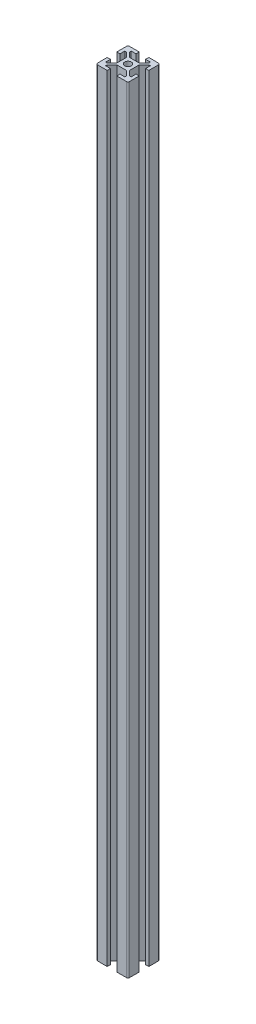
from build123d import *

# Parameters (mm, degrees)
SKETCH1_W           = 8
SKETCH1_H           = 8
SKETCH1_R           = 2.1
BOSS_EXTRUDE1_DEPTH = 485
FILLET1_R           = 1


with BuildPart() as part:
    # Sketch1 → Boss-Extrude1 (new body)
    # profile 1 of 6: a face of its own
    with BuildSketch(Plane(origin=(0, 0, 0), x_dir=(1, 0, 0), z_dir=(0, 1, 0))):
        Polygon((-4, 4), (-10, 10), (-10, 3), (-8, 3), (-8, 6), (-7, 6), (-4, 3), align=None)
    # profile 2 of 6: a face of its own
    with BuildSketch(Plane(origin=(0, 0, 0), x_dir=(1, 0, 0), z_dir=(0, 1, 0))):
        Polygon((-3, 8), (-3, 10), (-10, 10), (-4, 4), (-3, 4), (-6, 7), (-6, 8), align=None)
    # profile 3 of 6: a face of its own
    with BuildSketch(Plane(origin=(0, 0, 0), x_dir=(1, 0, 0), z_dir=(0, 1, 0))):
        Polygon((6, 7), (3, 4), (4, 4), (4, 3), (7, 6), (8, 6), (8, 3), (10, 3), (10, 10), (3, 10), (3, 8), (6, 8), align=None)
    # profile 4 of 6: a face of its own
    with BuildSketch(Plane(origin=(0, 0, 0), x_dir=(1, 0, 0), z_dir=(0, 1, 0))):
        Rectangle(SKETCH1_W, SKETCH1_H)
        with Locations(Location((0, 0, 0), (0, 0, 270))):
            Circle(SKETCH1_R, mode=Mode.SUBTRACT)
    # profile 5 of 6: a face of its own
    with BuildSketch(Plane(origin=(0, 0, 0), x_dir=(1, 0, 0), z_dir=(0, 1, 0))):
        Polygon((4, -4), (3, -4), (6, -7), (6, -8), (3, -8), (3, -10), (10, -10), (10, -3), (8, -3), (8, -6), (7, -6), (4, -3), align=None)
    # profile 6 of 6: a face of its own
    with BuildSketch(Plane(origin=(0, 0, 0), x_dir=(1, 0, 0), z_dir=(0, 1, 0))):
        Polygon((-4, -4), (-4, -3), (-7, -6), (-8, -6), (-8, -3), (-10, -3), (-10, -10), (-3, -10), (-3, -8), (-6, -8), (-6, -7), (-3, -4), align=None)
    extrude(amount=BOSS_EXTRUDE1_DEPTH)

    # Fillet1
    fillet1_edges = [part.edges().sort_by_distance(p)[0] for p in [
        (-10, 242.5, 10),
        (-10, 242.5, -10),
        (10, 242.5, -10),
        (10, 242.5, 10),
    ]]
    fillet(fillet1_edges, radius=FILLET1_R)


solid = part.part
